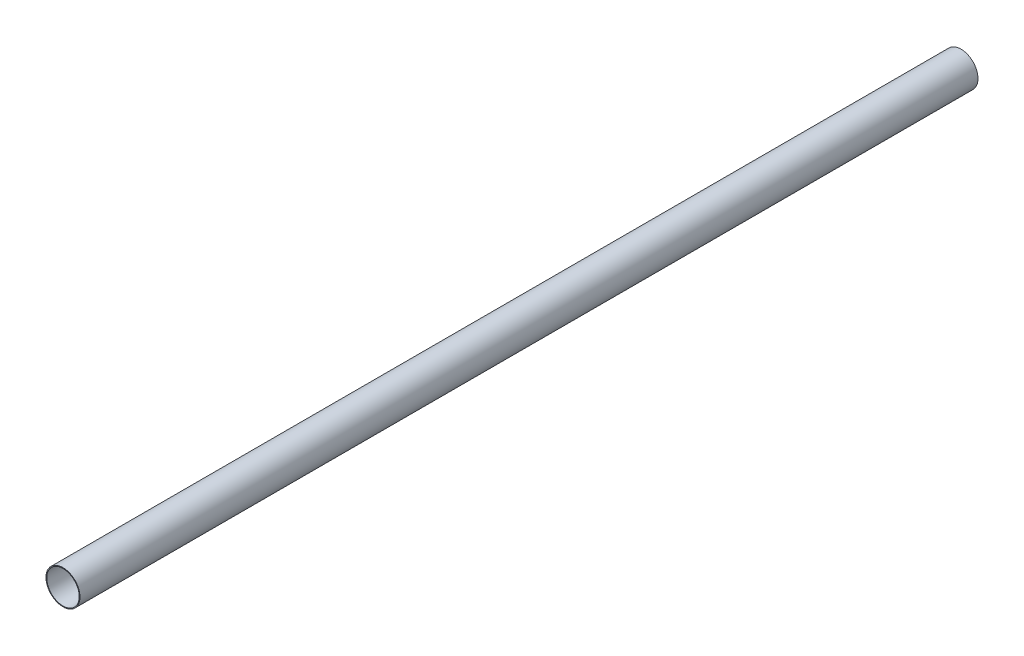
from build123d import *

# Parameters (mm, degrees)
SKETCH1_R           = 1.5875
SKETCH1_R_2         = 1.515846853
BOSS_EXTRUDE1_DEPTH = 83.82


with BuildPart() as part:
    # Sketch1 → Boss-Extrude1 (new body)
    with BuildSketch(Plane.XY):
        Circle(SKETCH1_R)
        Circle(SKETCH1_R_2, mode=Mode.SUBTRACT)
    extrude(amount=BOSS_EXTRUDE1_DEPTH)


solid = part.part
